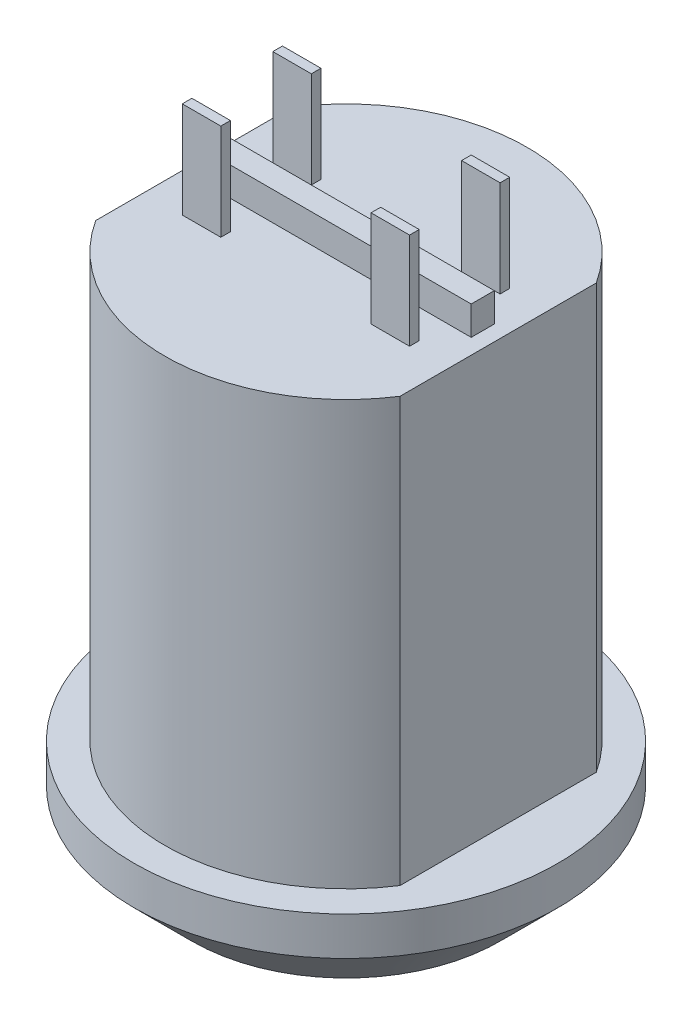
from build123d import *

# Parameters (mm, degrees)
SKETCH_1_R          = 11
EXTRUDE_1_DEPTH     = 5
CHAMFER_1_SIZE      = 3
EXTRUDE_3_DEPTH     = 22
SKETCH_4_W          = 2
SKETCH_4_H          = 7.5
CUT_EXTRUDE_1_DEPTH = 10
SKETCH_6_W          = 2
SKETCH_6_H          = 0.5
EXTRUDE_1_2_DEPTH   = 5
SKETCH_7_W          = 14.2
SKETCH_7_H          = 1.2
EXTRUDE_2_DEPTH     = 1.5


with BuildPart() as part:
    # 草图1 → Extrude 1 (new body)
    with BuildSketch(Plane(origin=(0, 0, 0), x_dir=(1, 0, 0), z_dir=(0, 1, 0))):
        with Locations(Location((0, 0, 0), (0, 0, 270))):
            Circle(SKETCH_1_R)
    extrude(amount=EXTRUDE_1_DEPTH)

    # 倒角1
    chamfer_1_edges = [part.edges().sort_by_distance(p)[0] for p in [
        (0, 0, -11),
    ]]
    chamfer(chamfer_1_edges, length=CHAMFER_1_SIZE)

    # 草图3 → 拉伸3 (add)
    with BuildSketch(Plane(origin=(0, 5, 0), x_dir=(-1, 0, 0), z_dir=(0, 1, 0))):
        with BuildLine():
            Line((-7.9, 5.094114251), (-7.9, -5.094114251))
            ThreePointArc((-7.9, -5.094114251), (0, -9.4), (7.9, -5.094114251))
            Line((7.9, -5.094114251), (7.9, 5.094114251))
            ThreePointArc((7.9, 5.094114251), (0, 9.4), (-7.9, 5.094114251))
        make_face()
    extrude(amount=EXTRUDE_3_DEPTH)

    # 草图4 → 切除-拉伸1 (cut)
    with BuildSketch(Plane(origin=(0, 0, 0), x_dir=(-1, 0, 0), z_dir=(0, 1, 0))):
        Rectangle(SKETCH_4_W, SKETCH_4_H)
    extrude(amount=CUT_EXTRUDE_1_DEPTH, mode=Mode.SUBTRACT)

    # 草图6 → Extrude 1 2 (add)
    with BuildSketch(Plane(origin=(0, 27, 0), x_dir=(1, 0, 0), z_dir=(0, 1, 0))):
        with Locations((4.9, 2.35)):
            Rectangle(SKETCH_6_W, SKETCH_6_H)
        with Locations((-4.9, 2.35)):
            Rectangle(SKETCH_6_W, SKETCH_6_H)
        with Locations((4.9, -2.35)):
            Rectangle(SKETCH_6_W, SKETCH_6_H)
        with Locations((-4.9, -2.35)):
            Rectangle(SKETCH_6_W, SKETCH_6_H)
    extrude(amount=EXTRUDE_1_2_DEPTH)

    # 草图7 → 凸台-拉伸2 (add)
    with BuildSketch(Plane(origin=(0, 27, 0), x_dir=(1, 0, 0), z_dir=(0, 1, 0))):
        Rectangle(SKETCH_7_W, SKETCH_7_H)
    extrude(amount=EXTRUDE_2_DEPTH)


solid = part.part
